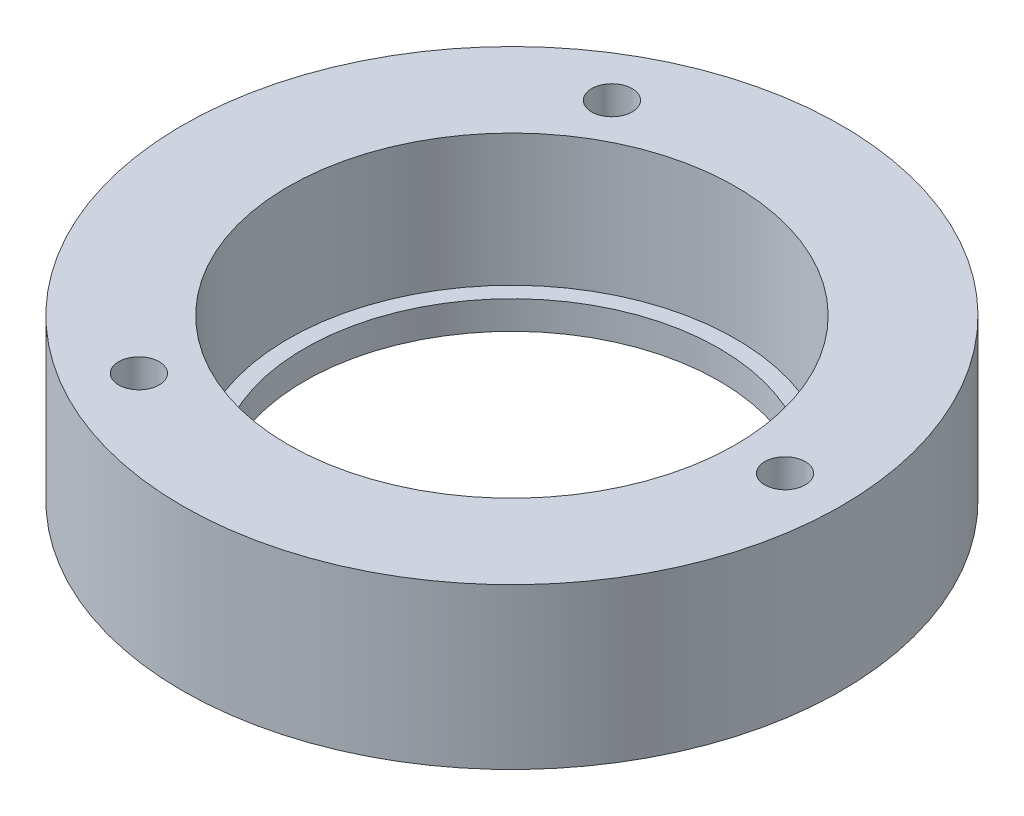
from build123d import *

# Parameters (mm, degrees)
SKETCH_1_R          = 35
SKETCH_1_R_2        = 22
EXTRUDE_1_DEPTH     = 3
SKETCH_2_R          = 35
SKETCH_2_R_2        = 23.75
EXTRUDE_2_DEPTH     = 14
SKETCH_4_R          = 2.15
CUT_EXTRUDE_1_DEPTH = 70
FILLET_1_R          = 2


with BuildPart() as part:
    # 草图1 → 凸台-拉伸1 (new body)
    with BuildSketch(Plane(origin=(0, 0, 0), x_dir=(1, 0, 0), z_dir=(0, 1, 0))):
        with Locations(Location((0, 0, 0), (0, 0, 270))):
            Circle(SKETCH_1_R)
        with Locations(Location((0, 0, 0), (0, 0, 270))):
            Circle(SKETCH_1_R_2, mode=Mode.SUBTRACT)
    extrude(amount=EXTRUDE_1_DEPTH)

    # 草图2 → 凸台-拉伸2 (add)
    with BuildSketch(Plane(origin=(0, 3, 0), x_dir=(1, 0, 0), z_dir=(0, 1, 0))):
        with Locations(Location((0, 0, 0), (0, 0, 270))):
            Circle(SKETCH_2_R)
        with Locations(Location((0, 0, 0), (0, 0, 270))):
            Circle(SKETCH_2_R_2, mode=Mode.SUBTRACT)
    extrude(amount=EXTRUDE_2_DEPTH)

    # 草图4 → 切除-拉伸1 (cut)
    with BuildSketch(Plane(origin=(0, 0, 0), x_dir=(1, 0, 0), z_dir=(0, 1, 0))):
        with Locations(Location((29, 0, 0), (0, 0, 270))):
            Circle(SKETCH_4_R)
        with Locations(Location((-14.5, -25.11473671, 0), (0, 0, 270))):
            Circle(SKETCH_4_R)
        with Locations(Location((-14.5, 25.11473671, 0), (0, 0, 270))):
            Circle(SKETCH_4_R)
    extrude(amount=CUT_EXTRUDE_1_DEPTH, mode=Mode.SUBTRACT)

    # 圆角1
    fillet_1_edges = [part.edges().sort_by_distance(p)[0] for p in [
        (29, 0, -2.15),
        (-14.5, 0, 22.96473671),
        (-14.5, 0, -27.26473671),
    ]]
    fillet(fillet_1_edges, radius=FILLET_1_R)


solid = part.part
